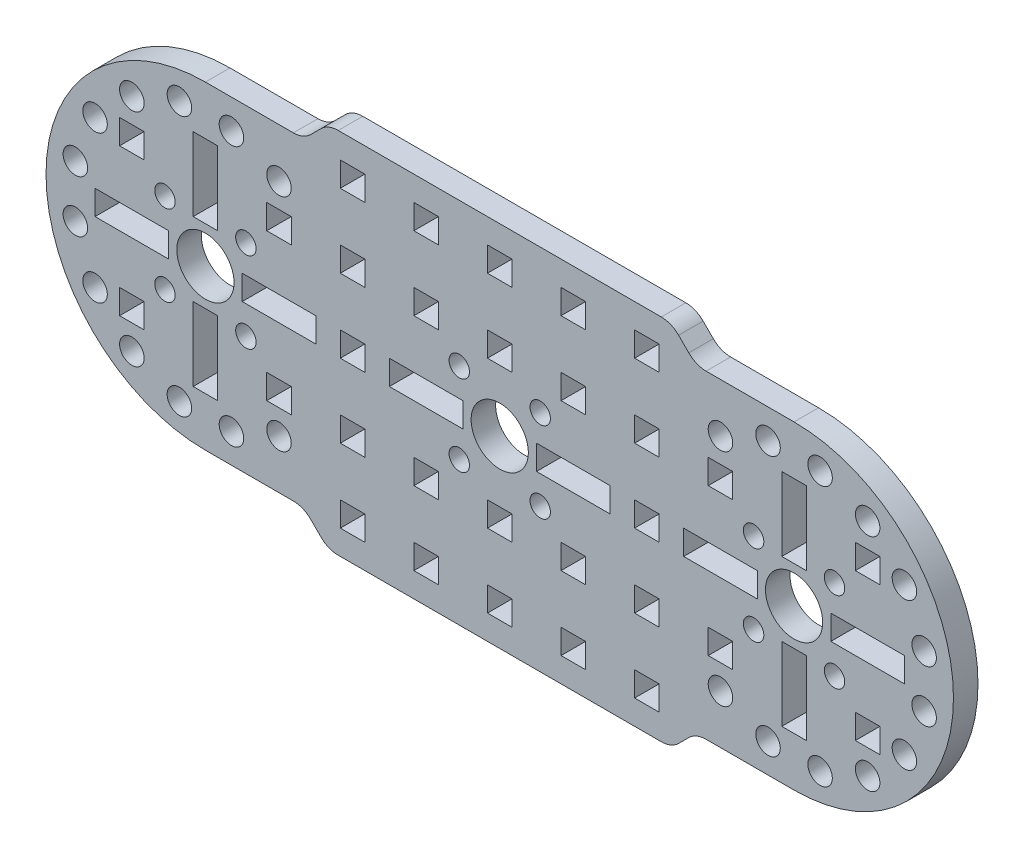
from build123d import *

# Parameters (mm, degrees)
MODEL_R                 = 1.25
MODEL_R_2               = 3.5
MODEL_R_3               = 1.5
MODEL_W                 = 9
MODEL_H                 = 3
MODEL_W_2               = 3
MODEL_H_2               = 9
SALIENTE_EXTRUIR1_DEPTH = 3


with BuildPart() as part:
    # Model → Saliente-Extruir1 (new body)
    with BuildSketch(Plane.XY):
        with BuildLine():
            Line((43.640298177, 300.645367074), (83.155016803, 300.645367074))
            ThreePointArc((83.155016803, 300.645367074), (84.3030671, 300.417005671), (85.276337146, 299.766687417))
            Line((85.276337146, 299.766687417), (86.518977834, 298.52404673))
            ThreePointArc((86.518977834, 298.52404673), (87.49224788, 297.873728476), (88.640298177, 297.645367074))
            Line((88.640298177, 297.645367074), (99.39765749, 297.645367074))
            ThreePointArc((99.39765749, 297.645367074), (118.89765749, 278.145367074), (99.39765749, 258.645367074))
            Line((99.39765749, 258.645367074), (88.640298177, 258.645367074))
            ThreePointArc((88.640298177, 258.645367074), (87.49224788, 258.417005671), (86.518977834, 257.766687417))
            Line((86.518977834, 257.766687417), (85.276337146, 256.52404673))
            ThreePointArc((85.276337146, 256.52404673), (84.3030671, 255.873728476), (83.155016803, 255.645367074))
            Line((83.155016803, 255.645367074), (43.640298177, 255.645367074))
            ThreePointArc((43.640298177, 255.645367074), (42.49224788, 255.873728476), (41.518977834, 256.52404673))
            Line((41.518977834, 256.52404673), (40.276337147, 257.766687417))
            ThreePointArc((40.276337147, 257.766687417), (39.3030671, 258.417005671), (38.155016803, 258.645367074))
            Line((38.155016803, 258.645367074), (27.39765749, 258.645367074))
            ThreePointArc((27.39765749, 258.645367074), (7.89765749, 278.145367074), (27.39765749, 297.645367074))
            Line((27.39765749, 297.645367074), (38.155016803, 297.645367074))
            ThreePointArc((38.155016803, 297.645367074), (39.3030671, 297.873728476), (40.276337147, 298.52404673))
            Line((40.276337147, 298.52404673), (41.518977834, 299.766687417))
            ThreePointArc((41.518977834, 299.766687417), (42.49224788, 300.417005671), (43.640298177, 300.645367074))
        make_face()
        with Locations((22.447910022, 283.095114542)):
            Circle(MODEL_R, mode=Mode.SUBTRACT)
        with Locations((22.447910022, 273.195619605)):
            Circle(MODEL_R, mode=Mode.SUBTRACT)
        with Locations((32.347404958, 273.195619605)):
            Circle(MODEL_R, mode=Mode.SUBTRACT)
        with Locations((32.347404958, 283.095114542)):
            Circle(MODEL_R, mode=Mode.SUBTRACT)
        with Locations((27.39765749, 278.145367074)):
            Circle(MODEL_R_2, mode=Mode.SUBTRACT)
        with Locations((18.39765749, 291.645367074)):
            Circle(MODEL_R_3, mode=Mode.SUBTRACT)
        with Locations((18.39765749, 264.645367074)):
            Circle(MODEL_R_3, mode=Mode.SUBTRACT)
        with Locations((36.39765749, 291.645367074)):
            Circle(MODEL_R_3, mode=Mode.SUBTRACT)
        with Locations((36.39765749, 264.645367074)):
            Circle(MODEL_R_3, mode=Mode.SUBTRACT)
        with Locations((13.89765749, 269.145367074)):
            Circle(MODEL_R_3, mode=Mode.SUBTRACT)
        with Locations((13.89765749, 287.145367074)):
            Circle(MODEL_R_3, mode=Mode.SUBTRACT)
        with Locations((30.579638005, 294.05526965)):
            Circle(MODEL_R_3, mode=Mode.SUBTRACT)
        with Locations((24.215676975, 262.235464497)):
            Circle(MODEL_R_3, mode=Mode.SUBTRACT)
        with Locations((30.579638005, 262.235464497)):
            Circle(MODEL_R_3, mode=Mode.SUBTRACT)
        with Locations((24.215676975, 294.05526965)):
            Circle(MODEL_R_3, mode=Mode.SUBTRACT)
        with Locations((11.487754913, 281.327347589)):
            Circle(MODEL_R_3, mode=Mode.SUBTRACT)
        with Locations((11.487754913, 274.963386558)):
            Circle(MODEL_R_3, mode=Mode.SUBTRACT)
        with Locations((94.447910022, 283.095114542)):
            Circle(MODEL_R, mode=Mode.SUBTRACT)
        with Locations((94.447910022, 273.195619605)):
            Circle(MODEL_R, mode=Mode.SUBTRACT)
        with Locations((104.347404958, 273.195619605)):
            Circle(MODEL_R, mode=Mode.SUBTRACT)
        with Locations((104.347404958, 283.095114542)):
            Circle(MODEL_R, mode=Mode.SUBTRACT)
        with Locations((99.39765749, 278.145367074)):
            Circle(MODEL_R_2, mode=Mode.SUBTRACT)
        with Locations((90.39765749, 291.645367074)):
            Circle(MODEL_R_3, mode=Mode.SUBTRACT)
        with Locations((90.39765749, 264.645367074)):
            Circle(MODEL_R_3, mode=Mode.SUBTRACT)
        with Locations((108.39765749, 291.645367074)):
            Circle(MODEL_R_3, mode=Mode.SUBTRACT)
        with Locations((108.39765749, 264.645367074)):
            Circle(MODEL_R_3, mode=Mode.SUBTRACT)
        with Locations((112.89765749, 269.145367074)):
            Circle(MODEL_R_3, mode=Mode.SUBTRACT)
        with Locations((112.89765749, 287.145367074)):
            Circle(MODEL_R_3, mode=Mode.SUBTRACT)
        with Locations((102.579638005, 294.05526965)):
            Circle(MODEL_R_3, mode=Mode.SUBTRACT)
        with Locations((96.215676975, 262.235464497)):
            Circle(MODEL_R_3, mode=Mode.SUBTRACT)
        with Locations((102.579638005, 262.235464497)):
            Circle(MODEL_R_3, mode=Mode.SUBTRACT)
        with Locations((96.215676975, 294.05526965)):
            Circle(MODEL_R_3, mode=Mode.SUBTRACT)
        with Locations((115.307560067, 274.963386558)):
            Circle(MODEL_R_3, mode=Mode.SUBTRACT)
        with Locations((115.307560067, 281.327347589)):
            Circle(MODEL_R_3, mode=Mode.SUBTRACT)
        with Locations((58.447910022, 283.095114542)):
            Circle(MODEL_R, mode=Mode.SUBTRACT)
        with Locations((58.447910022, 273.195619605)):
            Circle(MODEL_R, mode=Mode.SUBTRACT)
        with Locations((68.347404958, 273.195619605)):
            Circle(MODEL_R, mode=Mode.SUBTRACT)
        with Locations((68.347404958, 283.095114542)):
            Circle(MODEL_R, mode=Mode.SUBTRACT)
        with Locations((63.39765749, 278.145367074)):
            Circle(MODEL_R_2, mode=Mode.SUBTRACT)
        with Locations((36.39765749, 278.145367074)):
            Rectangle(MODEL_W, MODEL_H, mode=Mode.SUBTRACT)
        with Locations((27.39765749, 287.145367074)):
            Rectangle(MODEL_W_2, MODEL_H_2, mode=Mode.SUBTRACT)
        with Locations((18.39765749, 278.145367074)):
            Rectangle(MODEL_W, MODEL_H, mode=Mode.SUBTRACT)
        with Locations((27.39765749, 269.145367074)):
            Rectangle(MODEL_W_2, MODEL_H_2, mode=Mode.SUBTRACT)
        with Locations((108.39765749, 278.145367074)):
            Rectangle(MODEL_W, MODEL_H, mode=Mode.SUBTRACT)
        with Locations((99.39765749, 287.145367074)):
            Rectangle(MODEL_W_2, MODEL_H_2, mode=Mode.SUBTRACT)
        with Locations((90.39765749, 278.145367074)):
            Rectangle(MODEL_W, MODEL_H, mode=Mode.SUBTRACT)
        with Locations((99.39765749, 269.145367074)):
            Rectangle(MODEL_W_2, MODEL_H_2, mode=Mode.SUBTRACT)
        with Locations((72.39765749, 278.145367074)):
            Rectangle(MODEL_W, MODEL_H, mode=Mode.SUBTRACT)
        with Locations((54.39765749, 278.145367074)):
            Rectangle(MODEL_W, MODEL_H, mode=Mode.SUBTRACT)
        with Locations((18.39765749, 287.145367074)):
            Rectangle(MODEL_W_2, MODEL_H, mode=Mode.SUBTRACT)
        with Locations((36.39765749, 269.145367074)):
            Rectangle(MODEL_W_2, MODEL_H, mode=Mode.SUBTRACT)
        with Locations((90.39765749, 287.145367074)):
            Rectangle(MODEL_W_2, MODEL_H, mode=Mode.SUBTRACT)
        with Locations((36.39765749, 287.145367074)):
            Rectangle(MODEL_W_2, MODEL_H, mode=Mode.SUBTRACT)
        with Locations((45.39765749, 260.145367074)):
            Rectangle(MODEL_W_2, MODEL_H, mode=Mode.SUBTRACT)
        with Locations((81.39765749, 260.145367074)):
            Rectangle(MODEL_W_2, MODEL_H, mode=Mode.SUBTRACT)
        with Locations((18.39765749, 269.145367074)):
            Rectangle(MODEL_W_2, MODEL_H, mode=Mode.SUBTRACT)
        with Locations((45.39765749, 278.145367074)):
            Rectangle(MODEL_W_2, MODEL_H, mode=Mode.SUBTRACT)
        with Locations((108.39765749, 287.145367074)):
            Rectangle(MODEL_W_2, MODEL_H, mode=Mode.SUBTRACT)
        with Locations((90.39765749, 269.145367074)):
            Rectangle(MODEL_W_2, MODEL_H, mode=Mode.SUBTRACT)
        with Locations((81.39765749, 278.145367074)):
            Rectangle(MODEL_W_2, MODEL_H, mode=Mode.SUBTRACT)
        with Locations((108.39765749, 269.145367074)):
            Rectangle(MODEL_W_2, MODEL_H, mode=Mode.SUBTRACT)
        with Locations((54.39765749, 260.145367074)):
            Rectangle(MODEL_W_2, MODEL_H, mode=Mode.SUBTRACT)
        with Locations((63.39765749, 260.145367074)):
            Rectangle(MODEL_W_2, MODEL_H, mode=Mode.SUBTRACT)
        with Locations((72.39765749, 260.145367074)):
            Rectangle(MODEL_W_2, MODEL_H, mode=Mode.SUBTRACT)
        with Locations((45.39765749, 269.145367074)):
            Rectangle(MODEL_W_2, MODEL_H, mode=Mode.SUBTRACT)
        with Locations((81.39765749, 269.145367074)):
            Rectangle(MODEL_W_2, MODEL_H, mode=Mode.SUBTRACT)
        with Locations((54.39765749, 269.145367074)):
            Rectangle(MODEL_W_2, MODEL_H, mode=Mode.SUBTRACT)
        with Locations((63.39765749, 269.145367074)):
            Rectangle(MODEL_W_2, MODEL_H, mode=Mode.SUBTRACT)
        with Locations((72.39765749, 269.145367074)):
            Rectangle(MODEL_W_2, MODEL_H, mode=Mode.SUBTRACT)
        with Locations((45.39765749, 287.145367074)):
            Rectangle(MODEL_W_2, MODEL_H, mode=Mode.SUBTRACT)
        with Locations((81.39765749, 287.145367074)):
            Rectangle(MODEL_W_2, MODEL_H, mode=Mode.SUBTRACT)
        with Locations((54.39765749, 287.145367074)):
            Rectangle(MODEL_W_2, MODEL_H, mode=Mode.SUBTRACT)
        with Locations((63.39765749, 287.145367074)):
            Rectangle(MODEL_W_2, MODEL_H, mode=Mode.SUBTRACT)
        with Locations((72.39765749, 287.145367074)):
            Rectangle(MODEL_W_2, MODEL_H, mode=Mode.SUBTRACT)
        with Locations((45.39765749, 296.145367074)):
            Rectangle(MODEL_W_2, MODEL_H, mode=Mode.SUBTRACT)
        with Locations((81.39765749, 296.145367074)):
            Rectangle(MODEL_W_2, MODEL_H, mode=Mode.SUBTRACT)
        with Locations((54.39765749, 296.145367074)):
            Rectangle(MODEL_W_2, MODEL_H, mode=Mode.SUBTRACT)
        with Locations((63.39765749, 296.145367074)):
            Rectangle(MODEL_W_2, MODEL_H, mode=Mode.SUBTRACT)
        with Locations((72.39765749, 296.145367074)):
            Rectangle(MODEL_W_2, MODEL_H, mode=Mode.SUBTRACT)
    extrude(amount=SALIENTE_EXTRUIR1_DEPTH)


solid = part.part
